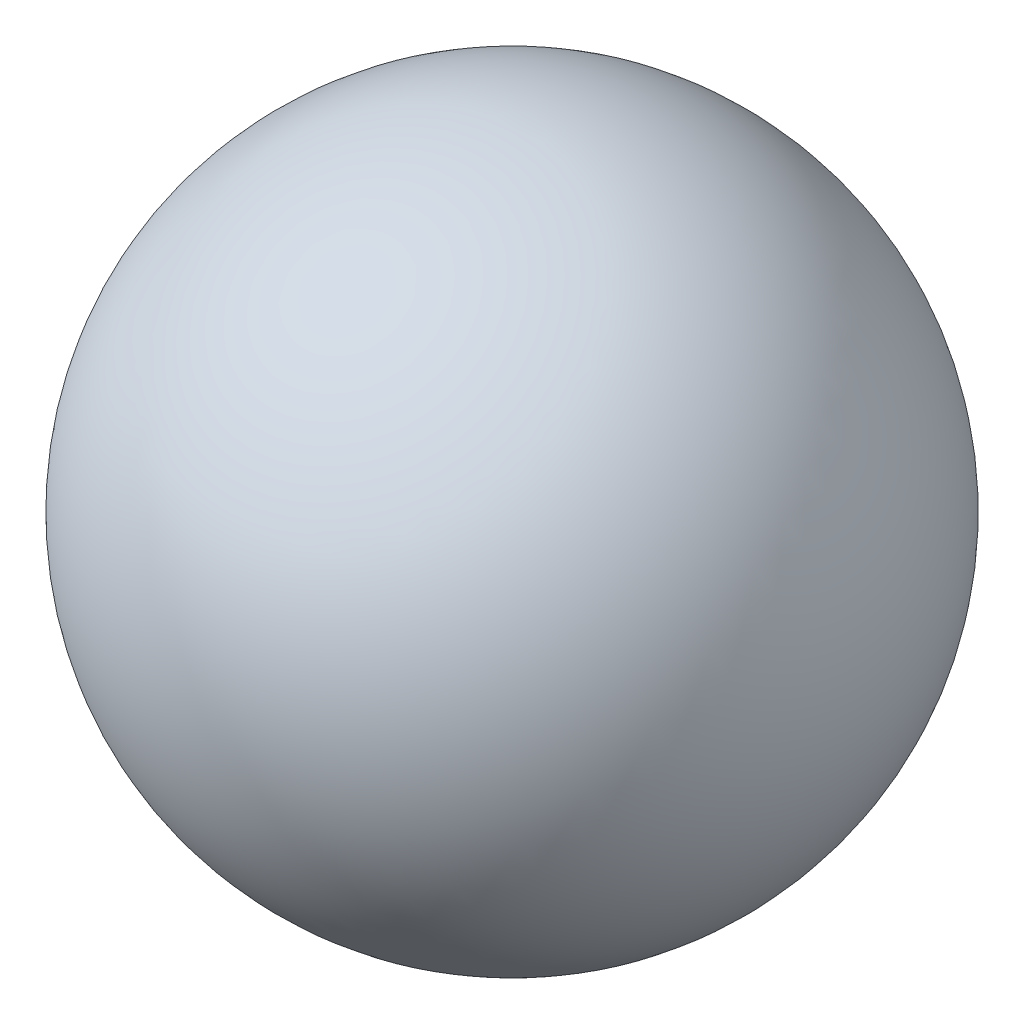
from build123d import *


with BuildPart() as part:
    # Sketch6 → Revolve7 (revolve)
    with BuildSketch(Plane.XY):
        with BuildLine():
            Line((18.644876348, 40.933004397), (18.644876348, -84.223406953))
            ThreePointArc((18.644876348, -84.223406953), (81.223082023, -21.645201278), (18.644876348, 40.933004397))
        make_face()
    revolve(axis=Axis((18.644876348, 40.933004397, 0), (0, -1, 0)))


solid = part.part
